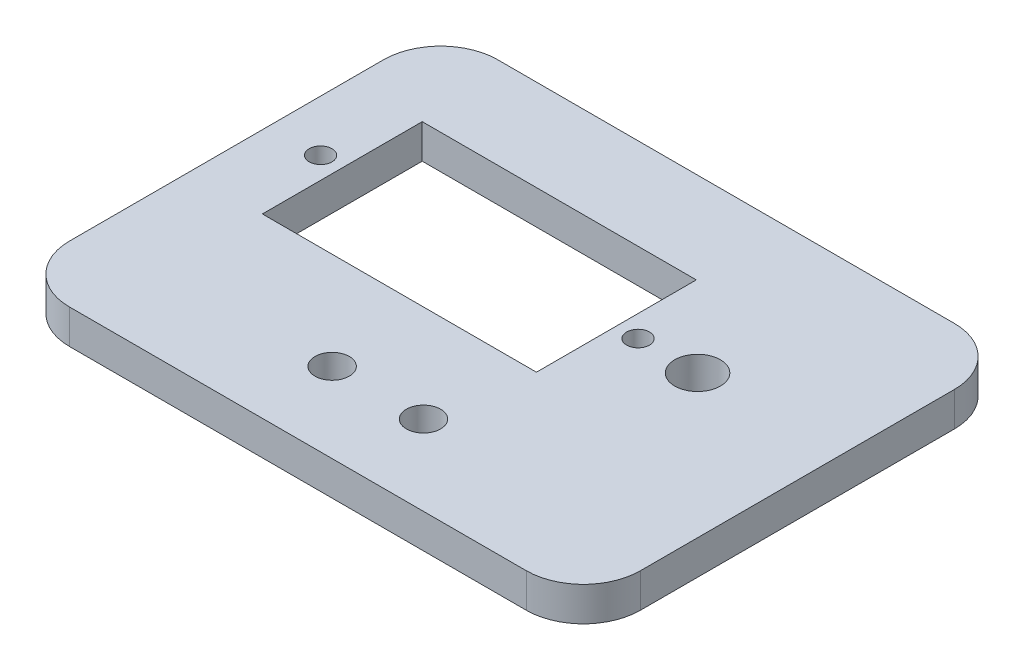
from build123d import *

# Parameters (mm, degrees)
SKETCH_1_W          = 50
SKETCH_1_H          = 37.5
SKETCH_1_R          = 1.5
SKETCH_1_R_2        = 1
SKETCH_1_W_2        = 24
SKETCH_1_H_2        = 14
EXTRUDE_1_DEPTH     = 3
FILLET_1_R          = 5
SKETCH_2_R          = 2
CUT_EXTRUDE_1_DEPTH = 10


with BuildPart() as part:
    # 草图1 → 凸台-拉伸1 (new body)
    with BuildSketch(Plane(origin=(0, 0, 0), x_dir=(1, 0, 0), z_dir=(0, 1, 0))):
        Rectangle(SKETCH_1_W, SKETCH_1_H)
        with Locations(Location((4, -11.75, 0), (0, 0, 270))):
            Circle(SKETCH_1_R, mode=Mode.SUBTRACT)
        with Locations(Location((-4, -11.75, 0), (0, 0, 90))):
            Circle(SKETCH_1_R, mode=Mode.SUBTRACT)
        with Locations(Location((7.29, 3.75, 0), (0, 0, 270))):
            Circle(SKETCH_1_R_2, mode=Mode.SUBTRACT)
        with Locations(Location((-20.51, 3.75, 0), (0, 0, 90))):
            Circle(SKETCH_1_R_2, mode=Mode.SUBTRACT)
        with Locations((-6.61, 3.75)):
            Rectangle(SKETCH_1_W_2, SKETCH_1_H_2, mode=Mode.SUBTRACT)
    extrude(amount=EXTRUDE_1_DEPTH)

    # 圆角1
    fillet_1_edges = [part.edges().sort_by_distance(p)[0] for p in [
        (25, 1.5, 18.75),
        (-25, 1.5, 18.75),
        (-25, 1.5, -18.75),
        (25, 1.5, -18.75),
    ]]
    fillet(fillet_1_edges, radius=FILLET_1_R)

    # 草图2 → 切除-拉伸1 (cut)
    with BuildSketch(Plane(origin=(0, 3, 0), x_dir=(1, 0, 0), z_dir=(0, 1, 0))):
        with Locations(Location((12.5, 3.75, 0), (0, 0, 270))):
            Circle(SKETCH_2_R)
    extrude(amount=-CUT_EXTRUDE_1_DEPTH, mode=Mode.SUBTRACT)


solid = part.part
